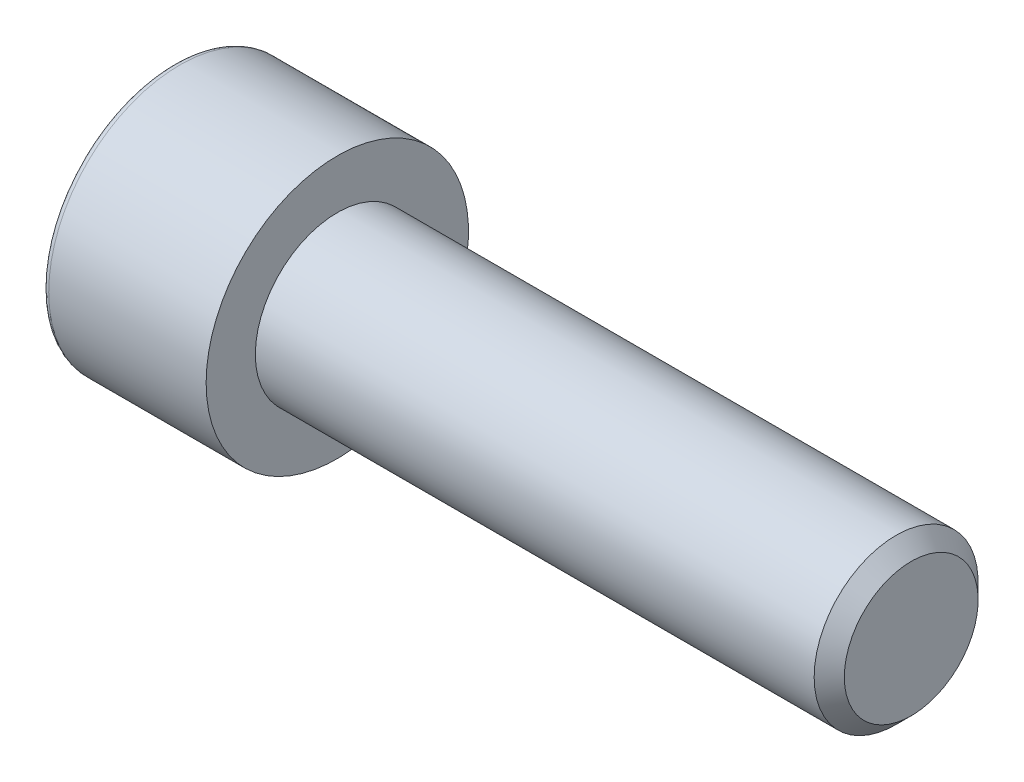
from build123d import *

# Parameters (mm, degrees)
SZKIC1_W                    = 10
SZKIC1_H                    = 8
SZKIC5_R                    = 6
DODANIE_WYCI_GNI_CIE1_DEPTH = 7.5


with BuildPart() as part:
    # Szkic1 → Obrót1 (revolve)
    with BuildSketch(Plane.XY):
        with Locations((5, 4)):
            Rectangle(SZKIC1_W, SZKIC1_H)
    revolve(axis=Axis((10, 0, 0), (-1, 0, 0)))

    # Szkic2 → Wycięcie-obrót1 (revolve, cut)
    with BuildSketch(Plane.XY):
        with BuildLine():
            Line((0, 8), (0, 7.6))
            ThreePointArc((0, 7.6), (0.117157288, 7.882842712), (0.4, 8))
            Line((0.4, 8), (0, 8))
        make_face()
    revolve(axis=Axis((10, 0, 0), (-1, 0, 0)), mode=Mode.SUBTRACT)

    # Szkic3 → Obrót2 (revolve)
    with BuildSketch(Plane.XY):
        Polygon((10, 0), (10, 5), (44.08, 5), (45, 4.08), (45, 0), align=None)
    revolve(axis=Axis((45, 0, 0), (-1, 0, 0)))

    # Szkic4 → Wycięcie-obrót2 (revolve, cut)
    with BuildSketch(Plane.XY):
        Polygon((0, 0), (0, 5.5), (5, 5.5), (8.175426481, 0), align=None)
    revolve(axis=Axis((8.175426481, 0, 0), (-1, 0, 0)), mode=Mode.SUBTRACT)

    # Szkic5 → Dodanie-wyciągnięcie1 (add)
    with BuildSketch(Plane(origin=(0, 0, 0), x_dir=(0, 0, -1), z_dir=(1, 0, 0))):
        Circle(SZKIC5_R)
        Polygon((-4, 2.309401077), (-4, -2.309401077), (0, -4.618802154), (4, -2.309401077), (4, 2.309401077), (0, 4.618802154), align=None, mode=Mode.SUBTRACT)
    extrude(amount=DODANIE_WYCI_GNI_CIE1_DEPTH)


solid = part.part
